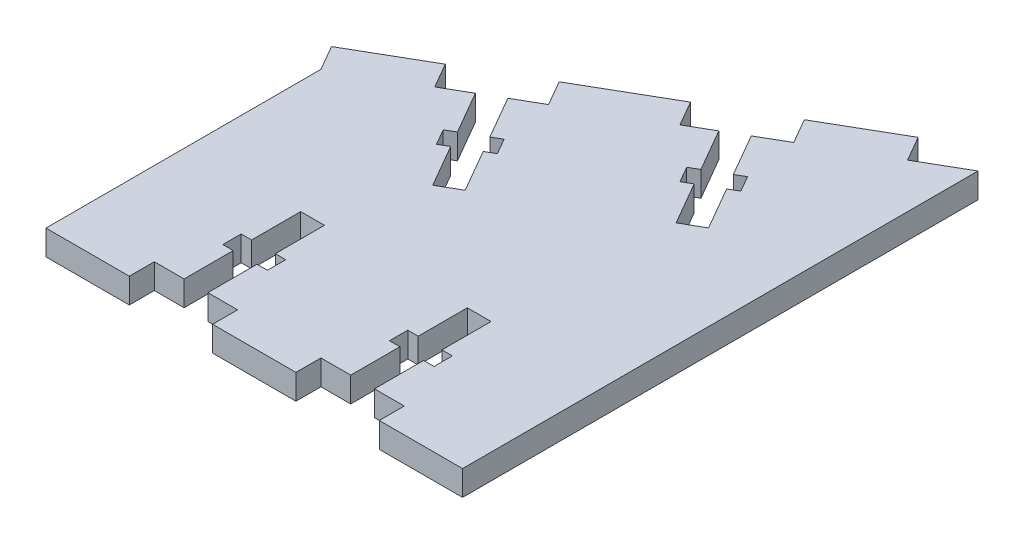
from build123d import *

# Parameters (mm, degrees)
SKETCH1_W           = 50
SKETCH1_H           = 30
SKETCH1_W_2         = 10
SKETCH1_H_2         = 3
BOSS_EXTRUDE1_DEPTH = 3
CUT_EXTRUDE1_DEPTH  = 60.983331018


with BuildPart() as part:
    # Sketch1 → Boss-Extrude1 (new body)
    with BuildSketch(Plane(origin=(0, 0, 0), x_dir=(1, 0, 0), z_dir=(0, 1, 0))):
        Polygon((50, 0), (50, 28.867513459), (0, 0), align=None)
        Polygon((-1.732050808, 3), (0, 0), (8.660254038, 5), (6.92820323, 8), align=None)
        with Locations((25, -15)):
            Rectangle(SKETCH1_W, SKETCH1_H)
        with Locations((5, -31.5)):
            Rectangle(SKETCH1_W_2, SKETCH1_H_2)
        with Locations((25, -31.5)):
            Rectangle(SKETCH1_W_2, SKETCH1_H_2)
        with Locations((45, -31.5)):
            Rectangle(SKETCH1_W_2, SKETCH1_H_2)
        Polygon((15.588457268, 13), (17.320508076, 10), (27.320508076, 15.773502692), (25.588457268, 18.773502692), align=None)
        Polygon((35.980762114, 20.773502692), (44.641016151, 25.773502692), (42.908965344, 28.773502692), (34.248711306, 23.773502692), align=None)
    extrude(amount=BOSS_EXTRUDE1_DEPTH)

    # Sketch2 → Cut-Extrude1 (cut, through all)
    with BuildSketch(Plane(origin=(0, 3, 0), x_dir=(1, 0, 0), z_dir=(0, 1, 0))):
        Polygon((14.224467257, 8.2125), (11.756294856, 6.7875), (14.706294856, 1.677950118), (13.623763102, 1.052950118), (14.723763102, -0.852305771), (15.806294856, -0.227305771), (18.756294856, -5.336855653), (21.224467257, -3.911855653), (18.274467257, 1.197694229), (19.356999012, 1.822694229), (18.256999012, 3.727950118), (17.174467257, 3.102950118), align=None)
        Polygon((32.745265622, 18.905487922), (30.277093221, 17.480487922), (33.211895488, 12.397261285), (32.129363734, 11.772261285), (33.229363734, 9.867005396), (34.311895488, 10.492005396), (37.277093221, 5.356132269), (39.745265622, 6.781132269), (36.780067889, 11.917005396), (37.862599644, 12.542005396), (36.762599644, 14.447261285), (35.680067889, 13.822261285), align=None)
        Polygon((36.425, -16), (33.575, -16), (33.575, -21.9), (32.325, -21.9), (32.325, -24.1), (33.575, -24.1), (33.575, -30), (36.425, -30), (36.425, -24.1), (37.675, -24.1), (37.675, -21.9), (36.425, -21.9), align=None)
        Polygon((16.425, -16), (13.575, -16), (13.575, -21.9), (12.325, -21.9), (12.325, -24.1), (13.575, -24.1), (13.575, -30), (16.425, -30), (16.425, -24.1), (17.675, -24.1), (17.675, -21.9), (16.425, -21.9), align=None)
    extrude(amount=-CUT_EXTRUDE1_DEPTH, mode=Mode.SUBTRACT)


solid = part.part
